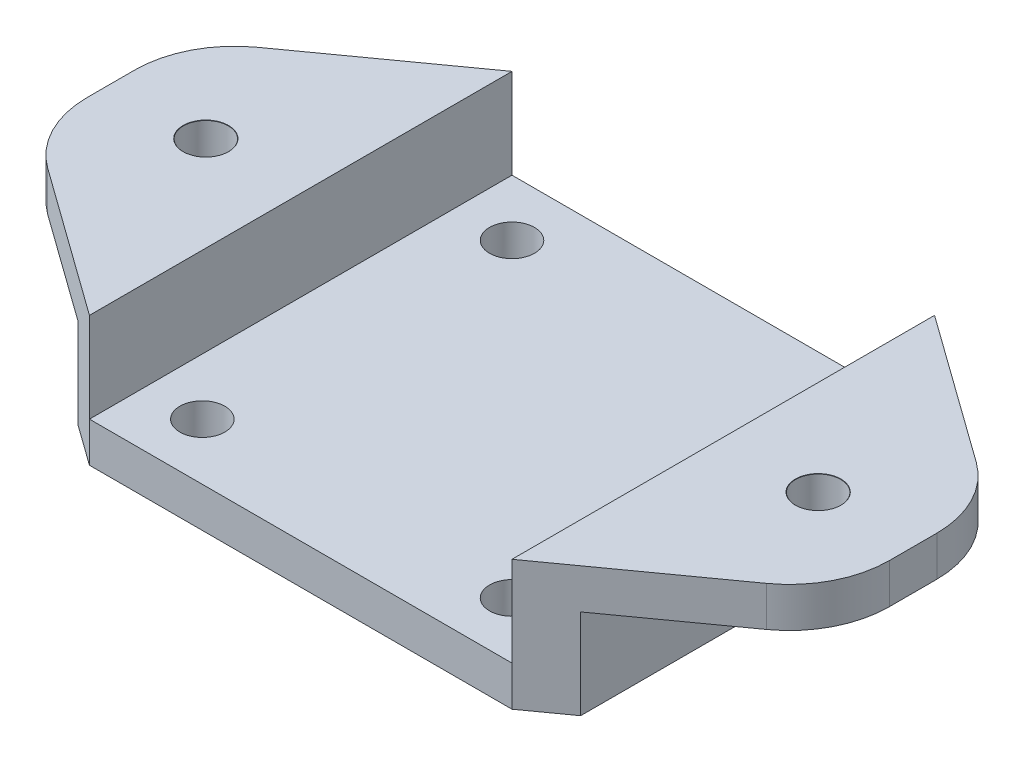
from build123d import *

# Parameters (mm, degrees)
SCHIZZO1_W                     = 50.3
SCHIZZO1_H                     = 42.3
ESTRUSIONE_ESTRUSIONE1_DEPTH   = 4
ESTRUSIONE_ESTRUSIONE2_DEPTH   = 42.3
SCHIZZO4_R                     = 2.25
TAGLIO_ESTRUSIONE1_DEPTH       = 42.3
FORO_PER_VITE_M4_1_D           = 4.5
FORO_PER_VITE_M4_1_DEPTH       = 4
FORO_PER_VITE_M4_1_CSINK_D     = 4.55
FORO_PER_VITE_M4_1_CSINK_ANGLE = 90
FORO_PER_VITE_M4_1_TIP         = 1.351936393
TAGLIO_ESTRUSIONE2_DEPTH       = 42.3
RACCORDO1_R                    = 10


with BuildPart() as part:
    # Schizzo1 → Estrusione-Estrusione1 (new body)
    with BuildSketch(Plane(origin=(0, 0, 0), x_dir=(1, 0, 0), z_dir=(0, 1, 0))):
        Rectangle(SCHIZZO1_W, SCHIZZO1_H)
    extrude(amount=ESTRUSIONE_ESTRUSIONE1_DEPTH)

    # Schizzo3 → Estrusione-Estrusione2 (add)
    with BuildSketch(Plane.XY.offset(21.15)):
        Polygon((-21.15, 4), (-21.15, 13), (-40.15, 13), (-40.15, 9), (-25.15, 9), (-25.15, 4), align=None)
        Polygon((25.15, 4), (25.15, 9), (40.15, 9), (40.15, 13), (21.15, 13), (21.15, 4), align=None)
    extrude(amount=-ESTRUSIONE_ESTRUSIONE2_DEPTH)

    # Schizzo4 → Taglio-Estrusione1 (cut)
    with BuildSketch(Plane(origin=(0, 4, 0), x_dir=(1, 0, 0), z_dir=(0, 1, 0))):
        with Locations(Location((-15.5, 15.5, 0), (0, 0, 270))):
            Circle(SCHIZZO4_R)
        with Locations(Location((15.5, 15.5, 0), (0, 0, 270))):
            Circle(SCHIZZO4_R)
        with Locations(Location((15.5, -15.5, 0), (0, 0, 270))):
            Circle(SCHIZZO4_R)
        with Locations(Location((-15.5, -15.5, 0), (0, 0, 270))):
            Circle(SCHIZZO4_R)
    extrude(amount=-TAGLIO_ESTRUSIONE1_DEPTH, mode=Mode.SUBTRACT)

    # Foro per Vite M4-1
    with Locations(Plane(origin=(0, 13, 0), x_dir=(1, 0, 0), z_dir=(0, 1, 0))):
        with Locations((-30.65, 0), (30.65, 0)):
            CounterSinkHole(FORO_PER_VITE_M4_1_D / 2, FORO_PER_VITE_M4_1_CSINK_D / 2, depth=FORO_PER_VITE_M4_1_DEPTH, counter_sink_angle=FORO_PER_VITE_M4_1_CSINK_ANGLE)
            with Locations((0, 0, -(FORO_PER_VITE_M4_1_DEPTH + FORO_PER_VITE_M4_1_TIP / 2))):  # 118° drill point
                Cone(0, FORO_PER_VITE_M4_1_D / 2, FORO_PER_VITE_M4_1_TIP, mode=Mode.SUBTRACT)

    # Schizzo7 → Taglio-Estrusione2 (cut)
    with BuildSketch(Plane(origin=(0, 13, 0), x_dir=(1, 0, 0), z_dir=(0, 1, 0))):
        Polygon((-21.15, -21.15), (-40.15, -7.5), (-40.15, -21.15), align=None)
        Polygon((-21.15, 21.15), (-40.15, 7.5), (-40.15, 21.15), align=None)
        Polygon((21.15, 21.15), (40.15, 21.15), (40.15, 7.5), align=None)
        Polygon((21.15, -21.15), (40.15, -21.15), (40.15, -7.5), align=None)
    extrude(amount=-TAGLIO_ESTRUSIONE2_DEPTH, mode=Mode.SUBTRACT)

    # Raccordo1
    raccordo1_edges = [part.edges().sort_by_distance(p)[0] for p in [
        (40.15, 11, 7.5),
        (40.15, 11, -7.5),
        (-40.15, 11, -7.5),
        (-40.15, 11, 7.5),
    ]]
    fillet(raccordo1_edges, radius=RACCORDO1_R)


solid = part.part
